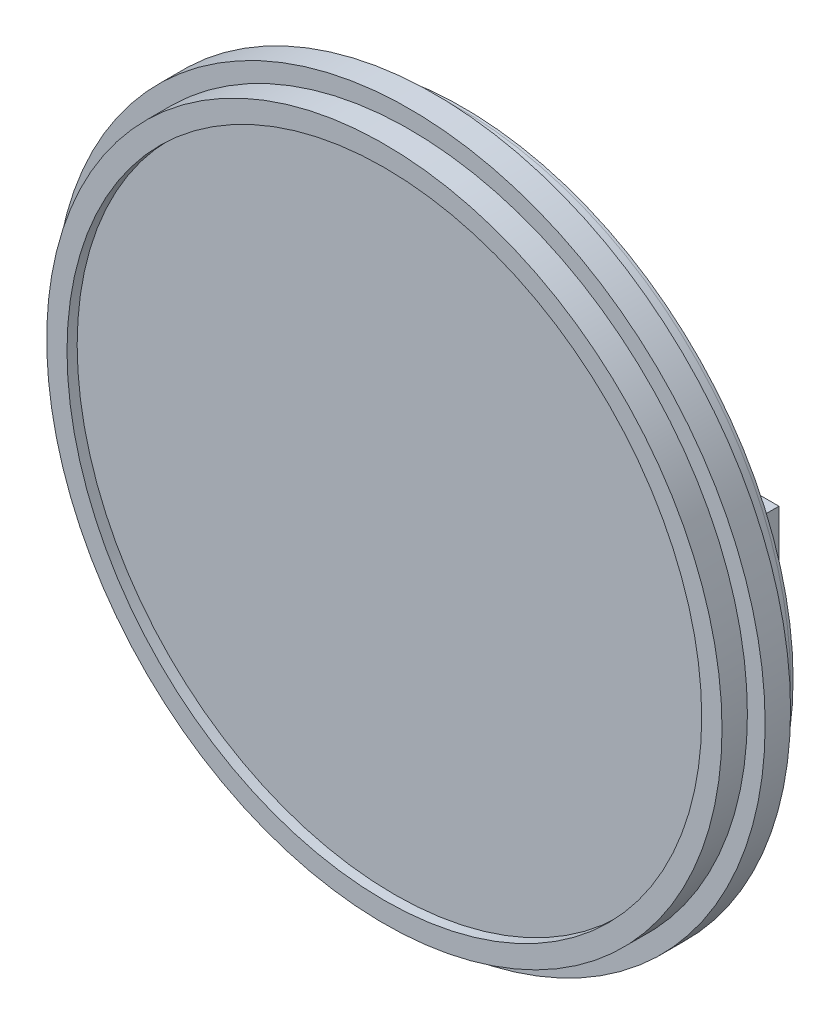
from build123d import *

# Parameters (mm, degrees)
SKETCH_1_R          = 14
EXTRUDE_1_DEPTH     = 1
SKETCH_2_R          = 13.3
EXTRUDE_2_DEPTH     = 1
SKETCH_3_R          = 12.5
CUT_EXTRUDE_2_DEPTH = 0.5
SKETCH_4_R          = 13
EXTRUDE_3_DEPTH     = 1
SKETCH_5_R          = 7.9
EXTRUDE_4_DEPTH     = 2
SKETCH_6_W          = 5.925942313
SKETCH_6_H          = 10.255153068
EXTRUDE_5_DEPTH     = 0.6
SKETCH_7_W          = 4.90352896
SKETCH_7_H          = 1.567823515
CUT_EXTRUDE_3_DEPTH = 0.6
SKETCH_8_R          = 12.5
EXTRUDE_6_DEPTH     = 0.1
SKETCH_9_R          = 13
EXTRUDE_7_DEPTH     = 0.1
EXTRUDE_9_DEPTH     = 0.1
EXTRUDE_9_2_DEPTH   = 0.1
EXTRUDE_9_3_DEPTH   = 0.1
EXTRUDE_9_4_DEPTH   = 0.1
EXTRUDE_9_5_DEPTH   = 0.1
EXTRUDE_9_6_DEPTH   = 0.1
EXTRUDE_9_7_DEPTH   = 0.1
EXTRUDE_9_8_DEPTH   = 0.1


with BuildPart() as part:
    # Эскиз1 → Бобышка-Вытянуть1 (new body)
    with BuildSketch(Plane.XY):
        Circle(SKETCH_1_R)
    extrude(amount=EXTRUDE_1_DEPTH)

    # Эскиз4 → Бобышка-Вытянуть3 (add)
    with BuildSketch(Plane(origin=(0, 0, 0), x_dir=(-1, 0, 0), z_dir=(0, 0, -1))):
        Circle(SKETCH_4_R)
    extrude(amount=EXTRUDE_3_DEPTH)

    # Эскиз5 → Бобышка-Вытянуть4 (add)
    with BuildSketch(Plane(origin=(0, 0, -1), x_dir=(-1, 0, 0), z_dir=(0, 0, -1))):
        Circle(SKETCH_5_R)
    extrude(amount=EXTRUDE_4_DEPTH)


with BuildPart() as body_2:
    # Эскиз2 → Бобышка-Вытянуть2 (new body)
    with BuildSketch(Plane.XY.offset(1)):
        Circle(SKETCH_2_R)
    extrude(amount=EXTRUDE_2_DEPTH)

    # Эскиз3 → Вырез-Вытянуть2 (cut)
    with BuildSketch(Plane.XY.offset(2)):
        Circle(SKETCH_3_R)
    extrude(amount=-CUT_EXTRUDE_2_DEPTH, mode=Mode.SUBTRACT)


with BuildPart() as body_3:
    # Эскиз6 → Бобышка-Вытянуть5 (new body)
    with BuildSketch(Plane(origin=(0, 0, -1), x_dir=(-1, 0, 0), z_dir=(0, 0, -1))):
        with Locations((-8.979626746, -0.00802035)):
            Rectangle(SKETCH_6_W, SKETCH_6_H)
    extrude(amount=EXTRUDE_5_DEPTH)


with BuildPart() as cut_extrude_3_tool:
    # Эскиз7 → Вырез-Вытянуть3 (new body)
    with BuildSketch(Plane(origin=(0, 0, -1.6), x_dir=(-1, 0, 0), z_dir=(0, 0, -1))):
        with Locations((-9.490833422, -0.069704626)):
            Rectangle(SKETCH_7_W, SKETCH_7_H)
    extrude(amount=-CUT_EXTRUDE_3_DEPTH)


with BuildPart() as part_1:
    add(part.part)

    # Вырез-Вытянуть3: cut by cut_extrude_3_tool
    add(cut_extrude_3_tool.part, mode=Mode.SUBTRACT)


with BuildPart() as body_3_1:
    add(body_3.part)

    # Вырез-Вытянуть3: cut by cut_extrude_3_tool
    add(cut_extrude_3_tool.part, mode=Mode.SUBTRACT)


with BuildPart() as body_4:
    # Эскиз8 → Бобышка-Вытянуть6 (new body)
    with BuildSketch(Plane.XY.offset(1.5)):
        Circle(SKETCH_8_R)
    extrude(amount=EXTRUDE_6_DEPTH)


with BuildPart() as body_5:
    # Эскиз9 → Бобышка-Вытянуть7 (new body)
    with BuildSketch(Plane(origin=(0, 0, -1), x_dir=(-1, 0, 0), z_dir=(0, 0, -1))):
        Circle(SKETCH_9_R)
    extrude(amount=EXTRUDE_7_DEPTH)


with BuildPart() as body_6:
    # Эскиз10 → Бобышка-Вытянуть9 (new body)
    with BuildSketch(Plane(origin=(0, 0, -3), x_dir=(-1, 0, 0), z_dir=(0, 0, -1))):
        with BuildLine():
            add(Edge.make_bspline(
                [(-4.168273117, 2.779709591), (-4.14661618, 2.768417207), (-4.104377919, 2.746393288), (-4.044221339, 2.710930936), (-3.989244701, 2.673555921), (-3.937922669, 2.636033575), (-3.891156922, 2.59692691), (-3.849470372, 2.556080417), (-3.811833302, 2.514513661), (-3.779004721, 2.47152277), (-3.750129731, 2.427221958), (-3.725174129, 2.381494948), (-3.703843268, 2.334441951), (-3.686937951, 2.285549348), (-3.673011953, 2.23553534), (-3.6634298, 2.183754128), (-3.658276534, 2.130546918), (-3.657302253, 2.094587547), (-3.656808941, 2.076380097)],
                knots=[0, 0, 0, 0, 1.272397273, 2.481599622, 3.635517121, 4.734568067, 5.792894095, 6.808321871, 7.773003508, 8.711915296, 9.623354172, 10.525449501, 11.423591555, 12.311487226, 13.218079475, 14.126165749, 15.051214107, 16, 16, 16, 16], degree=3))
            add(Edge.make_bspline(
                [(-3.656808941, 2.076380097), (-3.657392098, 2.050906216), (-3.658546385, 2.000483846), (-3.66860054, 1.926063274), (-3.683653803, 1.85378532), (-3.70563653, 1.78366583), (-3.734146057, 1.71609172), (-3.769280332, 1.651005147), (-3.809051898, 1.58733936), (-3.840992579, 1.54816636), (-3.857154494, 1.528344907)],
                knots=[0, 0, 0, 0, 1.025265484, 2.029385089, 3.018602448, 3.995076438, 4.983346944, 5.966715145, 6.97116228, 8, 8, 8, 8], degree=3))
            add(Edge.make_bspline(
                [(-3.857154494, 1.528344907), (-3.878197543, 1.505217471), (-3.920023606, 1.45924839), (-3.991674986, 1.399565337), (-4.070310577, 1.349408355), (-4.155626102, 1.308532577), (-4.247393506, 1.276717672), (-4.345593236, 1.253855769), (-4.450416732, 1.240760837), (-4.52246313, 1.23886794), (-4.559423958, 1.237896857)],
                knots=[0, 0, 0, 0, 0.954267603, 1.896743057, 2.838368354, 3.796610408, 4.779680527, 5.799409237, 6.871065594, 8, 8, 8, 8], degree=3))
            add(Edge.make_bspline(
                [(-4.559423958, 1.237896857), (-4.594963841, 1.238768075), (-4.664120844, 1.240463378), (-4.764781859, 1.251949645), (-4.858612989, 1.272079044), (-4.94615981, 1.299629433), (-5.026894537, 1.335469308), (-5.100587119, 1.380076855), (-5.168300777, 1.431656576), (-5.227980551, 1.491689838), (-5.280964077, 1.555989539), (-5.327506594, 1.622325577), (-5.36619176, 1.690704008), (-5.398944981, 1.76010525), (-5.424018427, 1.831502045), (-5.441384324, 1.904527055), (-5.45241315, 1.979052729), (-5.453880556, 2.02934749), (-5.45461877, 2.054649494)],
                knots=[0, 0, 0, 0, 1.256902934, 2.445805442, 3.576955095, 4.645999104, 5.686449165, 6.692658513, 7.68621702, 8.689161843, 9.678783111, 10.630372946, 11.551080876, 12.453998257, 13.34127905, 14.221779781, 15.105423033, 16, 16, 16, 16], degree=3))
            add(Edge.make_bspline(
                [(-5.45461877, 2.054649494), (-5.45418192, 2.073215074), (-5.453318549, 2.109907213), (-5.44734286, 2.16411605), (-5.437735868, 2.216878604), (-5.424688541, 2.268389762), (-5.407006039, 2.318274509), (-5.385656331, 2.366769213), (-5.360761343, 2.413928621), (-5.331973796, 2.460010632), (-5.298483575, 2.504369549), (-5.260562245, 2.547758188), (-5.217451891, 2.58950329), (-5.169632114, 2.630114885), (-5.117649396, 2.670313389), (-5.060153525, 2.70792635), (-4.998668692, 2.745616597), (-4.954970558, 2.768150272), (-4.9325543, 2.779709591)],
                knots=[0, 0, 0, 0, 0.941657376, 1.861047343, 2.762797495, 3.66048619, 4.553285746, 5.444104102, 6.34607688, 7.256116206, 8.197091036, 9.162375105, 10.176350973, 11.237807142, 12.343728897, 13.50695164, 14.721116704, 16, 16, 16, 16], degree=3))
            add(Edge.make_bspline(
                [(-4.9325543, 2.779709591), (-4.963239447, 2.796442422), (-5.022654479, 2.828841866), (-5.10132602, 2.888370702), (-5.168901075, 2.952844228), (-5.223522201, 3.023623895), (-5.266514897, 3.098498615), (-5.296011104, 3.176999925), (-5.315965589, 3.257672225), (-5.317942274, 3.312785838), (-5.318935009, 3.340465133)],
                knots=[0, 0, 0, 0, 1.166880483, 2.259407225, 3.286803203, 4.280235371, 5.237608625, 6.161067461, 7.076446754, 8, 8, 8, 8], degree=3))
            add(Edge.make_bspline(
                [(-5.318935009, 3.340465133), (-5.317698707, 3.368660311), (-5.315213523, 3.425337536), (-5.295117798, 3.509706451), (-5.262369891, 3.592571354), (-5.217828423, 3.673530613), (-5.162351182, 3.749844168), (-5.095792186, 3.818288812), (-5.019740884, 3.878244516), (-4.934576901, 3.928572932), (-4.84292808, 3.969533198), (-4.746229884, 3.997789506), (-4.646167119, 4.016262047), (-4.578057533, 4.018353506), (-4.543523518, 4.019413951)],
                knots=[0, 0, 0, 0, 0.888701115, 1.786444228, 2.72001202, 3.692817113, 4.693886446, 5.687152267, 6.695133018, 7.739871481, 8.800368666, 9.853104506, 10.91144658, 12, 12, 12, 12], degree=3))
            add(Edge.make_bspline(
                [(-4.543523518, 4.019413951), (-4.509880753, 4.018320584), (-4.443541053, 4.01616459), (-4.346027257, 3.998182843), (-4.252723927, 3.968149218), (-4.163952818, 3.927405484), (-4.081303132, 3.877220118), (-4.008276387, 3.816440886), (-3.943769018, 3.748298166), (-3.890410577, 3.672007751), (-3.846442203, 3.591359581), (-3.81582545, 3.506978271), (-3.796206993, 3.420687018), (-3.793732486, 3.362298765), (-3.792492702, 3.333044927)],
                knots=[0, 0, 0, 0, 1.072916533, 2.115669174, 3.151510826, 4.193348718, 5.225979165, 6.227137561, 7.216255879, 8.211077061, 9.189680878, 10.138522389, 11.067357538, 12, 12, 12, 12], degree=3))
            add(Edge.make_bspline(
                [(-3.792492702, 3.333044927), (-3.793577161, 3.304336378), (-3.795706978, 3.247954418), (-3.813623004, 3.165762346), (-3.843795568, 3.088789733), (-3.88499056, 3.016163156), (-3.938682447, 2.949199762), (-4.004154525, 2.887048026), (-4.080884809, 2.829197388), (-4.138534407, 2.796550553), (-4.168273117, 2.779709591)],
                knots=[0, 0, 0, 0, 0.975232327, 1.915300861, 2.843280834, 3.77672583, 4.742871857, 5.749627742, 6.839139064, 8, 8, 8, 8], degree=3))
        make_face()
        with BuildLine():
            add(Edge.make_bspline(
                [(-4.556773885, 3.74804643), (-4.575333125, 3.747553971), (-4.611643114, 3.746590508), (-4.664883835, 3.741556896), (-4.715511756, 3.731764881), (-4.764055843, 3.718733236), (-4.809850541, 3.701128626), (-4.853517793, 3.680419303), (-4.894314419, 3.655241504), (-4.932732904, 3.626998217), (-4.967318311, 3.595933937), (-4.998013418, 3.563568804), (-5.023510267, 3.529267169), (-5.045161581, 3.493882278), (-5.060871419, 3.456363925), (-5.072637292, 3.417862381), (-5.080590963, 3.377891109), (-5.081186948, 3.350573628), (-5.081488428, 3.33675503)],
                knots=[0, 0, 0, 0, 1.203892937, 2.355340988, 3.463153438, 4.544400666, 5.610487187, 6.640501085, 7.674077295, 8.714426146, 9.728707835, 10.68524104, 11.601827946, 12.495867327, 13.368432065, 14.231010473, 15.105153427, 16, 16, 16, 16], degree=3))
            add(Edge.make_bspline(
                [(-5.081488428, 3.33675503), (-5.080968812, 3.322935835), (-5.079941974, 3.295627121), (-5.072000598, 3.255300187), (-5.060164761, 3.215671926), (-5.041530035, 3.17768463), (-5.019179276, 3.140020543), (-4.991593458, 3.103620993), (-4.958717824, 3.068359303), (-4.921655413, 3.034535392), (-4.881278834, 3.002861922), (-4.838503992, 2.975365529), (-4.793867732, 2.952358791), (-4.747828668, 2.933210967), (-4.699917579, 2.918326312), (-4.650428043, 2.907766681), (-4.599351741, 2.901203504), (-4.564743802, 2.900419566), (-4.54723362, 2.900022925)],
                knots=[0, 0, 0, 0, 0.873023192, 1.725219244, 2.590779336, 3.480155217, 4.391973325, 5.357036234, 6.360879153, 7.436073238, 8.526419356, 9.601555421, 10.645666583, 11.697338044, 12.750135903, 13.812665442, 14.89329948, 16, 16, 16, 16], degree=3))
            add(Edge.make_bspline(
                [(-4.54723362, 2.900022925), (-4.524743959, 2.900682771), (-4.479986764, 2.901995946), (-4.414007746, 2.914205464), (-4.349855627, 2.933411128), (-4.288216099, 2.959688007), (-4.230684656, 2.992668592), (-4.179400795, 3.032154266), (-4.134801953, 3.077233292), (-4.097351611, 3.127203888), (-4.068315596, 3.180386339), (-4.045711254, 3.233756798), (-4.032511406, 3.287884675), (-4.030789674, 3.324145416), (-4.029939283, 3.342055177)],
                knots=[0, 0, 0, 0, 1.076279235, 2.141928126, 3.20205304, 4.278698113, 5.344010996, 6.36967002, 7.368914609, 8.37248503, 9.349703398, 10.264243087, 11.142681841, 12, 12, 12, 12], degree=3))
            add(Edge.make_bspline(
                [(-4.029939283, 3.342055177), (-4.030341372, 3.35462518), (-4.031139462, 3.379574835), (-4.03771629, 3.416418718), (-4.048583735, 3.452424416), (-4.063296897, 3.48788937), (-4.082656682, 3.522315995), (-4.105610562, 3.556245472), (-4.133493488, 3.588914532), (-4.164787221, 3.6210845), (-4.200275714, 3.650856946), (-4.239890576, 3.677039138), (-4.283428709, 3.699273479), (-4.330891142, 3.71733224), (-4.382103078, 3.730895802), (-4.436828644, 3.741053041), (-4.495524149, 3.746777953), (-4.535914496, 3.747614433), (-4.556773885, 3.74804643)],
                knots=[0, 0, 0, 0, 0.814439003, 1.616544685, 2.417341072, 3.248991801, 4.09997495, 4.973547432, 5.9003056, 6.880240646, 7.880314356, 8.896779544, 9.951930927, 11.043077905, 12.18215768, 13.381699519, 14.647792085, 16, 16, 16, 16], degree=3))
        make_face(mode=Mode.SUBTRACT)
        with BuildLine():
            add(Edge.make_bspline(
                [(-4.541403459, 2.628655404), (-4.564933071, 2.628236877), (-4.611092427, 2.62741583), (-4.678717605, 2.618276744), (-4.74361851, 2.605554524), (-4.805576319, 2.586254426), (-4.864564869, 2.56115946), (-4.920903492, 2.53097085), (-4.974161191, 2.495285782), (-5.023602538, 2.454557627), (-5.068750531, 2.410667444), (-5.10836115, 2.364204997), (-5.141999157, 2.316033796), (-5.169087388, 2.265542052), (-5.191321257, 2.213798917), (-5.205921629, 2.159515795), (-5.215281613, 2.103736251), (-5.216538483, 2.065817605), (-5.217172189, 2.046699274)],
                knots=[0, 0, 0, 0, 1.140299081, 2.23698856, 3.303958914, 4.344563908, 5.37730929, 6.408454204, 7.439741482, 8.480804886, 9.510774543, 10.48932336, 11.43758569, 12.353841022, 13.263987381, 14.161954604, 15.073269652, 16, 16, 16, 16], degree=3))
            add(Edge.make_bspline(
                [(-5.217172189, 2.046699274), (-5.21614163, 2.022939006), (-5.214097026, 1.975799189), (-5.197876829, 1.906128295), (-5.171845203, 1.838681427), (-5.135540427, 1.774008224), (-5.090585774, 1.713569751), (-5.035305646, 1.660888355), (-4.973135489, 1.614078666), (-4.901971754, 1.576220168), (-4.824238331, 1.545985962), (-4.739955893, 1.525154966), (-4.65033402, 1.511365298), (-4.588452066, 1.509975721), (-4.556773885, 1.509264378)],
                knots=[0, 0, 0, 0, 0.898778495, 1.783155532, 2.693654817, 3.627872908, 4.583023416, 5.533784346, 6.509005473, 7.520592997, 8.575161974, 9.658835044, 10.801527049, 12, 12, 12, 12], degree=3))
            add(Edge.make_bspline(
                [(-4.556773885, 1.509264378), (-4.532016166, 1.509739727), (-4.483780191, 1.51066586), (-4.413411647, 1.518840952), (-4.347005351, 1.531805251), (-4.284690081, 1.550661384), (-4.225768249, 1.573680116), (-4.171238869, 1.603292345), (-4.119699149, 1.636971779), (-4.07368877, 1.676930029), (-4.031783904, 1.719625837), (-3.995246237, 1.764824263), (-3.963528326, 1.811296913), (-3.938634091, 1.860094006), (-3.918732697, 1.910279352), (-3.904427391, 1.962315721), (-3.895600728, 2.016362712), (-3.894708027, 2.053025701), (-3.894255522, 2.071609965)],
                knots=[0, 0, 0, 0, 1.224942928, 2.386581632, 3.501229538, 4.569074225, 5.605009692, 6.626002462, 7.634866581, 8.645888296, 9.63523824, 10.59253846, 11.518950513, 12.414518923, 13.29783783, 14.186679152, 15.080837789, 16, 16, 16, 16], degree=3))
            add(Edge.make_bspline(
                [(-3.894255522, 2.071609965), (-3.894940301, 2.089660097), (-3.896290564, 2.125251805), (-3.904860563, 2.177991977), (-3.919916017, 2.228945295), (-3.940574228, 2.278724764), (-3.968076503, 2.326321756), (-4.000465185, 2.372976243), (-4.039543477, 2.417393317), (-4.083700618, 2.459917979), (-4.131823761, 2.499239399), (-4.1829769, 2.534024123), (-4.236766285, 2.563318878), (-4.293078094, 2.587143848), (-4.351787288, 2.605881994), (-4.412850686, 2.618972062), (-4.476339781, 2.627211643), (-4.519470546, 2.628168713), (-4.541403459, 2.628655404)],
                knots=[0, 0, 0, 0, 0.917430815, 1.809013306, 2.70690318, 3.612392954, 4.541220862, 5.495268465, 6.494511384, 7.542276156, 8.608045339, 9.649016899, 10.681629292, 11.715607085, 12.752076957, 13.808767841, 14.885711793, 16, 16, 16, 16], degree=3))
        make_face(mode=Mode.SUBTRACT)
    extrude(amount=EXTRUDE_9_DEPTH)


with BuildPart() as body_7:
    # Эскиз10 → Extrude 9 2 (new body)
    with BuildSketch(Plane(origin=(0, 0, -3), x_dir=(-1, 0, 0), z_dir=(0, 0, -1))):
        with BuildLine():
            Line((-1.57067112, 1.543185318), (-0.739608086, 1.543185318))
            Line((-0.739608086, 1.543185318), (-0.739608086, 1.305738737))
            Line((-0.739608086, 1.305738737), (-1.799637467, 1.305738737))
            Line((-1.799637467, 1.305738737), (-1.799637467, 1.638587963))
            add(Edge.make_bspline(
                [(-1.799637467, 1.638587963), (-1.753212017, 1.667164785), (-1.664097228, 1.722018694), (-1.538130234, 1.804409409), (-1.42617257, 1.884526251), (-1.327285463, 1.961188241), (-1.241627221, 2.034748183), (-1.168948173, 2.105157094), (-1.1096607, 2.172611842), (-1.063391598, 2.23840586), (-1.026990368, 2.303057268), (-0.99564101, 2.36712496), (-0.968934762, 2.43205634), (-0.947235012, 2.497787395), (-0.930162161, 2.564356126), (-0.917849429, 2.631631995), (-0.911002497, 2.699888928), (-0.909811563, 2.745597844), (-0.909212787, 2.768579282)],
                knots=[0, 0, 0, 0, 1.726964002, 3.314949702, 4.76710701, 6.087048124, 7.277484141, 8.342115976, 9.29034651, 10.117945271, 10.885025448, 11.63844732, 12.376368569, 13.107316574, 13.829469602, 14.551817793, 15.271885803, 16, 16, 16, 16], degree=3))
            add(Edge.make_bspline(
                [(-0.909212787, 2.768579282), (-0.910149043, 2.80501337), (-0.911978552, 2.876208091), (-0.925678264, 2.980203721), (-0.949795372, 3.078316694), (-0.982632089, 3.170926046), (-1.024523247, 3.258220808), (-1.077011872, 3.33899492), (-1.138455706, 3.414394279), (-1.208896944, 3.483411382), (-1.28656499, 3.545867999), (-1.370746147, 3.60027566), (-1.46083765, 3.645674519), (-1.556189367, 3.684023737), (-1.657911989, 3.711831356), (-1.764590307, 3.733528909), (-1.877273981, 3.745566602), (-1.954198336, 3.747206147), (-1.993622843, 3.74804643)],
                knots=[0, 0, 0, 0, 1.062437509, 2.076076205, 3.052086407, 4.003844546, 4.937153008, 5.869009602, 6.806518597, 7.768404322, 8.739669964, 9.708677912, 10.685721217, 11.677931361, 12.700644098, 13.756614884, 14.850242544, 16, 16, 16, 16], degree=3))
            add(Edge.make_bspline(
                [(-1.993622843, 3.74804643), (-2.033048662, 3.747204402), (-2.110151227, 3.745557702), (-2.22299046, 3.733503711), (-2.329996354, 3.712082995), (-2.431471117, 3.683025121), (-2.527629438, 3.646109289), (-2.617405537, 3.599588873), (-2.701813276, 3.545230913), (-2.779881485, 3.48303287), (-2.850545543, 3.41381967), (-2.911690597, 3.337994711), (-2.964251258, 3.257046657), (-3.006671681, 3.170128038), (-3.039846359, 3.077717826), (-3.062792989, 2.979537828), (-3.077600505, 2.875915124), (-3.079290459, 2.804849107), (-3.080152958, 2.768579282)],
                knots=[0, 0, 0, 0, 1.14892738, 2.246884138, 3.302092558, 4.325479714, 5.319883682, 6.298567514, 7.266875878, 8.241460862, 9.202652146, 10.143479939, 11.074663772, 12.009555506, 12.955777966, 13.929873195, 14.943473424, 16, 16, 16, 16], degree=3))
            add(Edge.make_bspline(
                [(-3.080152958, 2.768579282), (-3.079786912, 2.745771678), (-3.079058786, 2.70040359), (-3.071909815, 2.632733984), (-3.060152454, 2.566039675), (-3.044429045, 2.500058576), (-3.023373415, 2.435242772), (-2.998697116, 2.370971138), (-2.96872323, 2.307861915), (-2.933870333, 2.24403199), (-2.888907616, 2.179011416), (-2.830122086, 2.112416533), (-2.758146615, 2.041626851), (-2.671375223, 1.968192165), (-2.571398331, 1.889843255), (-2.456858912, 1.808767603), (-2.328407536, 1.723939181), (-2.237241861, 1.667830563), (-2.189728279, 1.638587963)],
                knots=[0, 0, 0, 0, 0.721480035, 1.435142872, 2.150161859, 2.863342861, 3.579344543, 4.304992334, 5.040202185, 5.788409948, 6.604059414, 7.535407846, 8.59480259, 9.795963414, 11.130050646, 12.612998473, 14.2347679, 16, 16, 16, 16], degree=3))
            Line((-2.189728279, 1.638587963), (-2.189728279, 1.305738737))
            Line((-2.189728279, 1.305738737), (-3.249757659, 1.305738737))
            Line((-3.249757659, 1.305738737), (-3.249757659, 1.543185318))
            Line((-3.249757659, 1.543185318), (-2.418694625, 1.543185318))
            add(Edge.make_bspline(
                [(-2.418694625, 1.543185318), (-2.462349921, 1.569908671), (-2.54683868, 1.621628005), (-2.665908074, 1.701443998), (-2.773316241, 1.780082743), (-2.869687932, 1.856792995), (-2.954574573, 1.932402883), (-3.028302265, 2.006566756), (-3.090174136, 2.079661563), (-3.140985361, 2.152430475), (-3.182467081, 2.225684659), (-3.218757482, 2.299590451), (-3.249784831, 2.375223246), (-3.273817355, 2.453274041), (-3.293898141, 2.532775788), (-3.307254584, 2.614526123), (-3.316261727, 2.697885071), (-3.317151489, 2.754068035), (-3.317599539, 2.782359664)],
                knots=[0, 0, 0, 0, 1.521507095, 2.944665499, 4.259859386, 5.477903256, 6.604940865, 7.637391614, 8.584217204, 9.448190317, 10.271606212, 11.084316444, 11.894783494, 12.698740799, 13.510160259, 14.330421164, 15.159262839, 16, 16, 16, 16], degree=3))
            add(Edge.make_bspline(
                [(-3.317599539, 2.782359664), (-3.316526206, 2.827293052), (-3.31442175, 2.915392729), (-3.296548205, 3.044117537), (-3.267514066, 3.166345739), (-3.2265163, 3.282048878), (-3.173926122, 3.391296693), (-3.109197411, 3.493744393), (-3.032909767, 3.589658088), (-2.945579892, 3.678123178), (-2.849691496, 3.758651461), (-2.745788753, 3.828069969), (-2.636023056, 3.887386582), (-2.519864916, 3.93571934), (-2.397223671, 3.973474533), (-2.268247738, 4.000322508), (-2.132900275, 4.016502435), (-2.040662589, 4.018430612), (-1.993622843, 4.019413951)],
                knots=[0, 0, 0, 0, 1.060031108, 2.07837429, 3.060328957, 4.020369746, 4.969556918, 5.915799986, 6.874309442, 7.856113616, 8.844790393, 9.824263403, 10.799921915, 11.784872792, 12.788496722, 13.823745093, 14.890144776, 16, 16, 16, 16], degree=3))
            add(Edge.make_bspline(
                [(-1.993622843, 4.019413951), (-1.946584005, 4.018426468), (-1.854348097, 4.016490165), (-1.719159791, 4.000389267), (-1.590395942, 3.97338687), (-1.4678996, 3.935741809), (-1.351787458, 3.88733352), (-1.242118068, 3.828397543), (-1.139039908, 3.758286432), (-1.043213502, 3.678176785), (-0.955973975, 3.589620887), (-0.879550956, 3.493911594), (-0.815535898, 3.391125236), (-0.762812189, 3.282072428), (-0.721861948, 3.166339248), (-0.692814665, 3.044119355), (-0.67494476, 2.915392245), (-0.672839798, 2.827292889), (-0.671766206, 2.782359664)],
                knots=[0, 0, 0, 0, 1.110772127, 2.178052811, 3.210072891, 4.214525961, 5.200290551, 6.176755099, 7.150120759, 8.139614327, 9.122229614, 10.081530939, 11.026337504, 11.976308843, 12.937142766, 13.91990867, 14.939093151, 16, 16, 16, 16], degree=3))
            add(Edge.make_bspline(
                [(-0.671766206, 2.782359664), (-0.672219642, 2.754069429), (-0.673120099, 2.697889235), (-0.682048171, 2.61450981), (-0.695693246, 2.532877227), (-0.714685375, 2.45308157), (-0.739788215, 2.375341793), (-0.770546869, 2.299571811), (-0.806915643, 2.225690062), (-0.848374425, 2.152427636), (-0.899198108, 2.079667776), (-0.961041302, 2.006541852), (-1.034790881, 1.932601556), (-1.119189619, 1.8564267), (-1.216051109, 1.780301833), (-1.323423829, 1.70140281), (-1.442536508, 1.621639497), (-1.527019041, 1.569912586), (-1.57067112, 1.543185318)],
                knots=[0, 0, 0, 0, 0.840708527, 1.669521974, 2.489754942, 3.299905053, 4.10542877, 4.915868217, 5.728550769, 6.551938621, 7.415882309, 8.362675653, 9.395091238, 10.51818009, 11.740285695, 13.055434789, 14.478544724, 16, 16, 16, 16], degree=3))
        make_face()
    extrude(amount=EXTRUDE_9_2_DEPTH)


with BuildPart() as body_8:
    # Эскиз10 → Extrude 9 3 (new body)
    with BuildSketch(Plane(origin=(0, 0, -3), x_dir=(-1, 0, 0), z_dir=(0, 0, -1))):
        Polygon((1.213496047, 3.951572071), (1.702699606, 3.951572071), (1.702699606, 1.305738737), (1.465253025, 1.305738737), (1.465253025, 3.680204549), (1.058201743, 3.680204549), align=None)
    extrude(amount=EXTRUDE_9_3_DEPTH)


with BuildPart() as body_9:
    # Эскиз10 → Extrude 9 4 (new body)
    with BuildSketch(Plane(origin=(0, 0, -3), x_dir=(-1, 0, 0), z_dir=(0, 0, -1))):
        Polygon((2.754248751, 3.951572071), (2.999645553, 3.951572071), (3.517469905, 2.01118829), (4.28758125, 3.951572071), (4.322032205, 3.951572071), (5.077833153, 2.024438657), (5.598307579, 3.951572071), (5.841054307, 3.951572071), (5.127654534, 1.305738737), (5.093733594, 1.305738737), (4.297651529, 3.329334824), (3.4920292, 1.305738737), (3.45810826, 1.305738737), align=None)
    extrude(amount=EXTRUDE_9_4_DEPTH)


with BuildPart() as body_10:
    # Эскиз10 → Extrude 9 5 (new body)
    with BuildSketch(Plane(origin=(0, 0, -3), x_dir=(-1, 0, 0), z_dir=(0, 0, -1))):
        with BuildLine():
            Line((-5.115409368, -2.272252716), (-5.35285595, -2.272252716))
            add(Edge.make_bspline(
                [(-5.35285595, -2.272252716), (-5.351308399, -2.240751509), (-5.348269052, -2.178883977), (-5.334035762, -2.088680786), (-5.313669742, -2.002460789), (-5.284874416, -1.920916271), (-5.249113123, -1.84332622), (-5.206227924, -1.769998827), (-5.155432572, -1.701213822), (-5.09782391, -1.637608863), (-5.035254761, -1.579258735), (-4.967743723, -1.528870545), (-4.896801351, -1.486297068), (-4.822642877, -1.450705891), (-4.744431618, -1.42399065), (-4.662877314, -1.404168339), (-4.577621658, -1.392242173), (-4.51953426, -1.39096024), (-4.489992034, -1.390308271)],
                knots=[0, 0, 0, 0, 1.10065271, 2.161652631, 3.183658789, 4.190468796, 5.17591951, 6.163126047, 7.15150782, 8.156236427, 9.156009102, 10.134482811, 11.092018607, 12.041330605, 13.001268258, 13.972401359, 14.968799086, 16, 16, 16, 16], degree=3))
            add(Edge.make_bspline(
                [(-4.489992034, -1.390308271), (-4.460980037, -1.390987462), (-4.403972501, -1.392322046), (-4.320770859, -1.403783062), (-4.241564214, -1.421733599), (-4.16650739, -1.446918467), (-4.096199234, -1.480773362), (-4.030111575, -1.521441739), (-3.967457629, -1.568476969), (-3.911058454, -1.623853364), (-3.859269608, -1.682970642), (-3.814591117, -1.746083522), (-3.776329976, -1.811268756), (-3.744438099, -1.879023408), (-3.720961137, -1.949985435), (-3.703137134, -2.023121714), (-3.693062244, -2.099189279), (-3.691516001, -2.150674592), (-3.690729881, -2.176850072)],
                knots=[0, 0, 0, 0, 1.111607364, 2.184268762, 3.212621178, 4.221274766, 5.211760367, 6.196651075, 7.1921475, 8.207485113, 9.220403448, 10.201281604, 11.166441695, 12.114753415, 13.065576456, 14.026450734, 14.996634279, 16, 16, 16, 16], degree=3))
            add(Edge.make_bspline(
                [(-3.690729881, -2.176850072), (-3.692009907, -2.213701113), (-3.694547497, -2.286756513), (-3.716254198, -2.394112986), (-3.750156025, -2.498127059), (-3.790975455, -2.581839186), (-3.832154029, -2.649295458), (-3.869261847, -2.704834301), (-3.912702508, -2.764634268), (-3.963108277, -2.828495112), (-4.019436461, -2.896917047), (-4.082197263, -2.969858737), (-4.151838228, -3.046566563), (-4.200716976, -3.098958297), (-4.226044718, -3.126106382)],
                knots=[0, 0, 0, 0, 1.184426356, 2.348067706, 3.509069118, 4.696110526, 5.333549288, 6.050745305, 6.844228056, 7.710549037, 8.667450064, 9.695053472, 10.805634456, 12, 12, 12, 12], degree=3))
            Line((-4.226044718, -3.126106382), (-4.888033066, -3.832615964))
            Line((-4.888033066, -3.832615964), (-3.656808941, -3.832615964))
            Line((-3.656808941, -3.832615964), (-3.656808941, -4.103983485))
            Line((-3.656808941, -4.103983485), (-5.45461877, -4.103983485))
            Line((-5.45461877, -4.103983485), (-4.42851033, -3.008973135))
            add(Edge.make_bspline(
                [(-4.42851033, -3.008973135), (-4.403527701, -2.982894058), (-4.355541184, -2.932801489), (-4.287669832, -2.859668417), (-4.226710596, -2.791822038), (-4.172268877, -2.72939054), (-4.125525691, -2.671460724), (-4.084044897, -2.619908776), (-4.050809004, -2.5724694), (-4.014738437, -2.517480959), (-3.979802867, -2.450343077), (-3.949782217, -2.368296776), (-3.931476945, -2.283836293), (-3.929281028, -2.226760349), (-3.928176462, -2.198050659)],
                knots=[0, 0, 0, 0, 1.329631726, 2.553950428, 3.673215718, 4.687767853, 5.603093632, 6.413772471, 7.123043292, 7.734684054, 8.834405432, 9.900288307, 10.943827018, 12, 12, 12, 12], degree=3))
            add(Edge.make_bspline(
                [(-3.928176462, -2.198050659), (-3.928657053, -2.179997459), (-3.929604206, -2.144418069), (-3.937963298, -2.092253001), (-3.950595645, -2.041933171), (-3.96869712, -1.993303799), (-3.992590311, -1.946853812), (-4.021674354, -1.902526669), (-4.055231128, -1.859672511), (-4.094050242, -1.819491148), (-4.136694665, -1.782690475), (-4.18174508, -1.75009072), (-4.229407956, -1.722846869), (-4.279482334, -1.700513392), (-4.331828612, -1.682993907), (-4.386548032, -1.670854386), (-4.443489402, -1.663232508), (-4.482370675, -1.662201259), (-4.502182372, -1.661675793)],
                knots=[0, 0, 0, 0, 0.991446411, 1.95395049, 2.89581595, 3.838931463, 4.798493298, 5.75982156, 6.748411868, 7.785213223, 8.824556874, 9.840280684, 10.836137867, 11.835679398, 12.848801643, 13.863922112, 14.911575587, 16, 16, 16, 16], degree=3))
            add(Edge.make_bspline(
                [(-4.502182372, -1.661675793), (-4.522873418, -1.662216323), (-4.563507216, -1.663277835), (-4.623166247, -1.670703302), (-4.68007871, -1.68351355), (-4.734387768, -1.701034012), (-4.786185312, -1.723303272), (-4.83521944, -1.751040484), (-4.881380077, -1.78413872), (-4.924753996, -1.821664617), (-4.964716647, -1.863444291), (-4.999828273, -1.91001849), (-5.030507855, -1.960536833), (-5.05727555, -2.014863012), (-5.079013482, -2.073489976), (-5.095624138, -2.13620961), (-5.108767766, -2.202749583), (-5.113158731, -2.248700213), (-5.115409368, -2.272252716)],
                knots=[0, 0, 0, 0, 1.031018746, 2.02475058, 2.990194455, 3.934040569, 4.864654155, 5.795059489, 6.735614925, 7.690564532, 8.649604399, 9.611025574, 10.590972636, 11.591080095, 12.624614302, 13.701020113, 14.821632451, 16, 16, 16, 16], degree=3))
        make_face()
    extrude(amount=EXTRUDE_9_5_DEPTH)


with BuildPart() as body_11:
    # Эскиз10 → Extrude 9 6 (new body)
    with BuildSketch(Plane(origin=(0, 0, -3), x_dir=(-1, 0, 0), z_dir=(0, 0, -1))):
        with BuildLine():
            add(Edge.make_bspline(
                [(-2.133016707, -2.630012632), (-2.111359769, -2.641305015), (-2.069121509, -2.663328934), (-2.008964929, -2.698791286), (-1.953988291, -2.736166301), (-1.902666259, -2.773688647), (-1.855900512, -2.812795312), (-1.814213961, -2.853641805), (-1.776576892, -2.895208561), (-1.743748311, -2.938199452), (-1.714873321, -2.982500265), (-1.689917719, -3.028227275), (-1.668586857, -3.075280271), (-1.651681541, -3.124172874), (-1.637755543, -3.174186882), (-1.628173389, -3.225968094), (-1.623020124, -3.279175304), (-1.622045843, -3.315134675), (-1.621552531, -3.333342125)],
                knots=[0, 0, 0, 0, 1.272397273, 2.481599622, 3.635517121, 4.734568067, 5.792894095, 6.808321871, 7.773003508, 8.711915296, 9.623354172, 10.525449501, 11.423591555, 12.311487226, 13.218079475, 14.126165749, 15.051214107, 16, 16, 16, 16], degree=3))
            add(Edge.make_bspline(
                [(-1.621552531, -3.333342125), (-1.622135688, -3.358816007), (-1.623289975, -3.409238376), (-1.633344129, -3.483658948), (-1.648397393, -3.555936902), (-1.670380119, -3.626056392), (-1.698889647, -3.693630502), (-1.734023922, -3.758717075), (-1.773795488, -3.822382862), (-1.805736168, -3.861555862), (-1.821898084, -3.881377315)],
                knots=[0, 0, 0, 0, 1.025265484, 2.029385089, 3.018602448, 3.995076438, 4.983346944, 5.966715145, 6.97116228, 8, 8, 8, 8], degree=3))
            add(Edge.make_bspline(
                [(-1.821898084, -3.881377315), (-1.842941133, -3.904504752), (-1.884767196, -3.950473832), (-1.956418576, -4.010156885), (-2.035054166, -4.060313868), (-2.120369692, -4.101189645), (-2.212137096, -4.13300455), (-2.310336825, -4.155866454), (-2.415160322, -4.168961385), (-2.48720672, -4.170854282), (-2.524167548, -4.171825365)],
                knots=[0, 0, 0, 0, 0.954267603, 1.896743057, 2.838368354, 3.796610408, 4.779680527, 5.799409237, 6.871065594, 8, 8, 8, 8], degree=3))
            add(Edge.make_bspline(
                [(-2.524167548, -4.171825365), (-2.559707431, -4.170954147), (-2.628864434, -4.169258844), (-2.729525448, -4.157772578), (-2.823356578, -4.137643178), (-2.9109034, -4.110092789), (-2.991638126, -4.074252914), (-3.065330709, -4.029645367), (-3.133044366, -3.978065646), (-3.192724141, -3.918032384), (-3.245707667, -3.853732683), (-3.292250183, -3.787396645), (-3.33093535, -3.719018214), (-3.363688571, -3.649616972), (-3.388762016, -3.578220177), (-3.406127913, -3.505195167), (-3.41715674, -3.430669494), (-3.418624146, -3.380374732), (-3.41936236, -3.355072728)],
                knots=[0, 0, 0, 0, 1.256902934, 2.445805442, 3.576955095, 4.645999104, 5.686449165, 6.692658513, 7.68621702, 8.689161843, 9.678783111, 10.630372946, 11.551080876, 12.453998257, 13.34127905, 14.221779781, 15.105423033, 16, 16, 16, 16], degree=3))
            add(Edge.make_bspline(
                [(-3.41936236, -3.355072728), (-3.418925509, -3.336507148), (-3.418062138, -3.29981501), (-3.41208645, -3.245606172), (-3.402479458, -3.192843618), (-3.389432131, -3.141332461), (-3.371749628, -3.091447713), (-3.350399921, -3.04295301), (-3.325504933, -2.995793601), (-3.296717385, -2.94971159), (-3.263227165, -2.905352673), (-3.225305834, -2.861964034), (-3.182195481, -2.820218932), (-3.134375703, -2.779607337), (-3.082392986, -2.739408833), (-3.024897115, -2.701795872), (-2.963412281, -2.664105625), (-2.919714147, -2.64157195), (-2.89729789, -2.630012632)],
                knots=[0, 0, 0, 0, 0.941657376, 1.861047343, 2.762797495, 3.66048619, 4.553285746, 5.444104102, 6.34607688, 7.256116206, 8.197091036, 9.162375105, 10.176350973, 11.237807142, 12.343728897, 13.50695164, 14.721116704, 16, 16, 16, 16], degree=3))
            add(Edge.make_bspline(
                [(-2.89729789, -2.630012632), (-2.927983036, -2.613279801), (-2.987398068, -2.580880356), (-3.06606961, -2.521351521), (-3.133644665, -2.456877994), (-3.188265791, -2.386098328), (-3.231258487, -2.311223607), (-3.260754694, -2.232722297), (-3.280709179, -2.152049997), (-3.282685864, -2.096936384), (-3.283678599, -2.069257089)],
                knots=[0, 0, 0, 0, 1.166880483, 2.259407225, 3.286803203, 4.280235371, 5.237608625, 6.161067461, 7.076446754, 8, 8, 8, 8], degree=3))
            add(Edge.make_bspline(
                [(-3.283678599, -2.069257089), (-3.282442296, -2.041061911), (-3.279957112, -1.984384686), (-3.259861388, -1.900015772), (-3.22711348, -1.817150868), (-3.182572012, -1.736191609), (-3.127094772, -1.659878054), (-3.060535776, -1.59143341), (-2.984484474, -1.531477706), (-2.899320491, -1.48114929), (-2.80767167, -1.440189024), (-2.710973474, -1.411932716), (-2.610910708, -1.393460176), (-2.542801123, -1.391368717), (-2.508267107, -1.390308271)],
                knots=[0, 0, 0, 0, 0.888701115, 1.786444228, 2.72001202, 3.692817113, 4.693886446, 5.687152267, 6.695133018, 7.739871481, 8.800368666, 9.853104506, 10.91144658, 12, 12, 12, 12], degree=3))
            add(Edge.make_bspline(
                [(-2.508267107, -1.390308271), (-2.474624342, -1.391401638), (-2.408284643, -1.393557632), (-2.310770847, -1.411539379), (-2.217467517, -1.441573004), (-2.128696408, -1.482316739), (-2.046046722, -1.532502104), (-1.973019976, -1.593281337), (-1.908512608, -1.661424057), (-1.855154167, -1.737714471), (-1.811185792, -1.818362641), (-1.78056904, -1.902743952), (-1.760950583, -1.989035204), (-1.758476076, -2.047423457), (-1.757236291, -2.076677295)],
                knots=[0, 0, 0, 0, 1.072916533, 2.115669174, 3.151510826, 4.193348718, 5.225979165, 6.227137561, 7.216255879, 8.211077061, 9.189680878, 10.138522389, 11.067357538, 12, 12, 12, 12], degree=3))
            add(Edge.make_bspline(
                [(-1.757236291, -2.076677295), (-1.758320751, -2.105385845), (-1.760450568, -2.161767804), (-1.778366594, -2.243959876), (-1.808539158, -2.320932489), (-1.84973415, -2.393559066), (-1.903426037, -2.46052246), (-1.968898115, -2.522674196), (-2.045628399, -2.580524834), (-2.103277997, -2.613171669), (-2.133016707, -2.630012632)],
                knots=[0, 0, 0, 0, 0.975232327, 1.915300861, 2.843280834, 3.77672583, 4.742871857, 5.749627742, 6.839139064, 8, 8, 8, 8], degree=3))
        make_face()
        with BuildLine():
            add(Edge.make_bspline(
                [(-2.521517475, -1.661675793), (-2.540076715, -1.662168251), (-2.576386704, -1.663131714), (-2.629627425, -1.668165326), (-2.680255346, -1.677957342), (-2.728799433, -1.690988987), (-2.77459413, -1.708593597), (-2.818261383, -1.729302919), (-2.859058009, -1.754480719), (-2.897476494, -1.782724005), (-2.932061901, -1.813788285), (-2.962757008, -1.846153418), (-2.988253856, -1.880455054), (-3.009905171, -1.915839945), (-3.025615009, -1.953358297), (-3.037380881, -1.991859841), (-3.045334552, -2.031831113), (-3.045930538, -2.059148595), (-3.046232018, -2.072967192)],
                knots=[0, 0, 0, 0, 1.203892937, 2.355340988, 3.463153438, 4.544400666, 5.610487187, 6.640501085, 7.674077295, 8.714426146, 9.728707835, 10.68524104, 11.601827946, 12.495867327, 13.368432065, 14.231010473, 15.105153427, 16, 16, 16, 16], degree=3))
            add(Edge.make_bspline(
                [(-3.046232018, -2.072967192), (-3.045712401, -2.086786387), (-3.044685564, -2.114095101), (-3.036744188, -2.154422035), (-3.024908351, -2.194050296), (-3.006273625, -2.232037592), (-2.983922866, -2.269701679), (-2.956337048, -2.306101229), (-2.923461413, -2.341362919), (-2.886399003, -2.37518683), (-2.846022424, -2.4068603), (-2.803247582, -2.434356693), (-2.758611322, -2.457363431), (-2.712572257, -2.476511255), (-2.664661169, -2.49139591), (-2.615171633, -2.501955542), (-2.56409533, -2.508518718), (-2.529487391, -2.509302657), (-2.51197721, -2.509699297)],
                knots=[0, 0, 0, 0, 0.873023192, 1.725219244, 2.590779336, 3.480155217, 4.391973325, 5.357036234, 6.360879153, 7.436073238, 8.526419356, 9.601555421, 10.645666583, 11.697338044, 12.750135903, 13.812665442, 14.89329948, 16, 16, 16, 16], degree=3))
            add(Edge.make_bspline(
                [(-2.51197721, -2.509699297), (-2.489487548, -2.509039451), (-2.444730354, -2.507726276), (-2.378751335, -2.495516758), (-2.314599217, -2.476311094), (-2.252959688, -2.450034215), (-2.195428246, -2.41705363), (-2.144144385, -2.377567956), (-2.099545543, -2.33248893), (-2.062095201, -2.282518334), (-2.033059186, -2.229335883), (-2.010454843, -2.175965424), (-1.997254996, -2.121837547), (-1.995533264, -2.085576806), (-1.994682873, -2.067667045)],
                knots=[0, 0, 0, 0, 1.076279235, 2.141928126, 3.20205304, 4.278698113, 5.344010996, 6.36967002, 7.368914609, 8.37248503, 9.349703398, 10.264243087, 11.142681841, 12, 12, 12, 12], degree=3))
            add(Edge.make_bspline(
                [(-1.994682873, -2.067667045), (-1.995084962, -2.055097042), (-1.995883051, -2.030147387), (-2.002459879, -1.993303504), (-2.013327325, -1.957297807), (-2.028040486, -1.921832852), (-2.047400272, -1.887406227), (-2.070354151, -1.85347675), (-2.098237078, -1.82080769), (-2.12953081, -1.788637722), (-2.165019304, -1.758865276), (-2.204634166, -1.732683084), (-2.248172299, -1.710448743), (-2.295634731, -1.692389982), (-2.346846668, -1.67882642), (-2.401572234, -1.668669181), (-2.460267738, -1.662944269), (-2.500658086, -1.662107789), (-2.521517475, -1.661675793)],
                knots=[0, 0, 0, 0, 0.814439003, 1.616544685, 2.417341072, 3.248991801, 4.09997495, 4.973547432, 5.9003056, 6.880240646, 7.880314356, 8.896779544, 9.951930927, 11.043077905, 12.18215768, 13.381699519, 14.647792085, 16, 16, 16, 16], degree=3))
        make_face(mode=Mode.SUBTRACT)
        with BuildLine():
            add(Edge.make_bspline(
                [(-2.506147049, -2.781066818), (-2.52967666, -2.781485345), (-2.575836017, -2.782306392), (-2.643461195, -2.791445478), (-2.7083621, -2.804167698), (-2.770319909, -2.823467796), (-2.829308458, -2.848562762), (-2.885647081, -2.878751373), (-2.938904781, -2.91443644), (-2.988346127, -2.955164596), (-3.03349412, -2.999054778), (-3.07310474, -3.045517225), (-3.106742747, -3.093688426), (-3.133830978, -3.144180171), (-3.156064847, -3.195923305), (-3.170665218, -3.250206428), (-3.180025203, -3.305985972), (-3.181282073, -3.343904617), (-3.181915779, -3.363022948)],
                knots=[0, 0, 0, 0, 1.140299081, 2.23698856, 3.303958914, 4.344563908, 5.37730929, 6.408454204, 7.439741482, 8.480804886, 9.510774543, 10.48932336, 11.43758569, 12.353841022, 13.263987381, 14.161954604, 15.073269652, 16, 16, 16, 16], degree=3))
            add(Edge.make_bspline(
                [(-3.181915779, -3.363022948), (-3.18088522, -3.386783216), (-3.178840615, -3.433923034), (-3.162620418, -3.503593927), (-3.136588793, -3.571040796), (-3.100284017, -3.635713998), (-3.055329364, -3.696152471), (-3.000049236, -3.748833867), (-2.937879079, -3.795643556), (-2.866715344, -3.833502055), (-2.78898192, -3.863736261), (-2.704699483, -3.884567256), (-2.615077609, -3.898356924), (-2.553195656, -3.899746501), (-2.521517475, -3.900457844)],
                knots=[0, 0, 0, 0, 0.898778495, 1.783155532, 2.693654817, 3.627872908, 4.583023416, 5.533784346, 6.509005473, 7.520592997, 8.575161974, 9.658835044, 10.801527049, 12, 12, 12, 12], degree=3))
            add(Edge.make_bspline(
                [(-2.521517475, -3.900457844), (-2.496759756, -3.899982495), (-2.448523781, -3.899056362), (-2.378155236, -3.890881271), (-2.311748941, -3.877916971), (-2.24943367, -3.859060838), (-2.190511839, -3.836042106), (-2.135982458, -3.806429877), (-2.084442738, -3.772750443), (-2.03843236, -3.732792194), (-1.996527494, -3.690096385), (-1.959989826, -3.64489796), (-1.928271916, -3.598425309), (-1.903377681, -3.549628216), (-1.883476287, -3.49944287), (-1.869170981, -3.447406502), (-1.860344318, -3.39335951), (-1.859451617, -3.356696522), (-1.858999112, -3.338112258)],
                knots=[0, 0, 0, 0, 1.224942928, 2.386581632, 3.501229538, 4.569074225, 5.605009692, 6.626002462, 7.634866581, 8.645888296, 9.63523824, 10.59253846, 11.518950513, 12.414518923, 13.29783783, 14.186679152, 15.080837789, 16, 16, 16, 16], degree=3))
            add(Edge.make_bspline(
                [(-1.858999112, -3.338112258), (-1.85968389, -3.320062125), (-1.861034154, -3.284470417), (-1.869604152, -3.231730245), (-1.884659607, -3.180776927), (-1.905317818, -3.130997458), (-1.932820093, -3.083400466), (-1.965208775, -3.036745979), (-2.004287067, -2.992328905), (-2.048444208, -2.949804243), (-2.096567351, -2.910482823), (-2.14772049, -2.875698099), (-2.201509875, -2.846403344), (-2.257821683, -2.822578375), (-2.316530877, -2.803840228), (-2.377594276, -2.79075016), (-2.441083371, -2.782510579), (-2.484214136, -2.781553509), (-2.506147049, -2.781066818)],
                knots=[0, 0, 0, 0, 0.917430815, 1.809013306, 2.70690318, 3.612392954, 4.541220862, 5.495268465, 6.494511384, 7.542276156, 8.608045339, 9.649016899, 10.681629292, 11.715607085, 12.752076957, 13.808767841, 14.885711793, 16, 16, 16, 16], degree=3))
        make_face(mode=Mode.SUBTRACT)
    extrude(amount=EXTRUDE_9_6_DEPTH)


with BuildPart() as body_12:
    # Эскиз10 → Extrude 9 7 (new body)
    with BuildSketch(Plane(origin=(0, 0, -3), x_dir=(-1, 0, 0), z_dir=(0, 0, -1))):
        with BuildLine():
            Line((-1.214501249, -2.170489895), (-0.977054667, -2.170489895))
            Line((-0.977054667, -2.170489895), (-0.977054667, -2.506519209))
            add(Edge.make_bspline(
                [(-0.977054667, -2.506519209), (-0.955673348, -2.477122034), (-0.914704691, -2.420794228), (-0.847526489, -2.346567049), (-0.780415975, -2.283574932), (-0.732085383, -2.250507404), (-0.708867234, -2.234621673)],
                knots=[0, 0, 0, 0, 1.134379233, 2.173579362, 3.122582517, 4, 4, 4, 4], degree=3))
            add(Edge.make_bspline(
                [(-0.708867234, -2.234621673), (-0.677219543, -2.219498569), (-0.614477083, -2.189516581), (-0.515130407, -2.159101926), (-0.413473961, -2.140410927), (-0.344827275, -2.137854769), (-0.310296187, -2.136568955)],
                knots=[0, 0, 0, 0, 1.014936303, 2.012140481, 3.000054389, 4, 4, 4, 4], degree=3))
            add(Edge.make_bspline(
                [(-0.310296187, -2.136568955), (-0.286942553, -2.137359145), (-0.240726966, -2.138922889), (-0.172249708, -2.149098034), (-0.105832781, -2.166686153), (-0.041868604, -2.191184547), (0.018396433, -2.220853173), (0.073648386, -2.25566456), (0.123257163, -2.294745087), (0.16719769, -2.339859518), (0.206710584, -2.392274685), (0.243055902, -2.453404207), (0.276639247, -2.524620712), (0.295251784, -2.576302562), (0.305050868, -2.603511897)],
                knots=[0, 0, 0, 0, 1.009824226, 1.998387844, 2.986035974, 3.974953746, 4.955485308, 5.885931332, 6.793869504, 7.679848016, 8.601185859, 9.625726857, 10.749998409, 12, 12, 12, 12], degree=3))
            add(Edge.make_bspline(
                [(0.305050868, -2.603511897), (0.315415921, -2.584821414), (0.33581289, -2.548041167), (0.370061794, -2.495987599), (0.405945188, -2.447299132), (0.443768882, -2.401937132), (0.483399373, -2.36012561), (0.52502317, -2.321726327), (0.568403332, -2.28657438), (0.628722466, -2.245508658), (0.707199854, -2.201889313), (0.806145036, -2.164070191), (0.909068082, -2.14069907), (0.978931461, -2.137954757), (1.014210523, -2.136568955)],
                knots=[0, 0, 0, 0, 0.86119277, 1.694706429, 2.50939023, 3.298075842, 4.073795165, 4.829715201, 5.57930267, 6.321991688, 7.768977793, 9.186738141, 10.579381044, 12, 12, 12, 12], degree=3))
            add(Edge.make_bspline(
                [(1.014210523, -2.136568955), (1.046626867, -2.137791497), (1.1100688, -2.14018413), (1.202428995, -2.158972173), (1.288563574, -2.191234442), (1.368299221, -2.235256298), (1.440235508, -2.290576276), (1.502765099, -2.356396171), (1.555508171, -2.432250416), (1.589963453, -2.503606264), (1.61333392, -2.566603807), (1.627743306, -2.620281182), (1.640473313, -2.679360035), (1.651042469, -2.743911006), (1.658767208, -2.814162121), (1.664490308, -2.889998414), (1.668363864, -2.971478826), (1.668637573, -3.027695603), (1.668778666, -3.056674457)],
                knots=[0, 0, 0, 0, 1.209669288, 2.367440248, 3.500751976, 4.631527125, 5.755587489, 6.87532382, 8.007944318, 9.190864318, 9.82315674, 10.514484317, 11.263564316, 12.079023757, 12.955305781, 13.901327259, 14.918167583, 16, 16, 16, 16], degree=3))
            Line((1.668778666, -3.056674457), (1.668778666, -4.103983485))
            Line((1.668778666, -4.103983485), (1.431332085, -4.103983485))
            Line((1.431332085, -4.103983485), (1.431332085, -3.055614428))
            add(Edge.make_bspline(
                [(1.431332085, -3.055614428), (1.431273209, -3.030879232), (1.431160058, -2.983341948), (1.429123801, -2.915115392), (1.425287106, -2.852924432), (1.420800801, -2.796853865), (1.414568874, -2.746772936), (1.406521056, -2.702782238), (1.397995667, -2.664535726), (1.38383215, -2.622137345), (1.36119297, -2.575366412), (1.326708328, -2.524926566), (1.283263664, -2.481020247), (1.233098546, -2.4429064), (1.175987519, -2.41191716), (1.113043353, -2.38978589), (1.044656838, -2.376085857), (0.997316992, -2.374720595), (0.972869378, -2.374015536)],
                knots=[0, 0, 0, 0, 1.253487763, 2.409012846, 3.458416907, 4.410876679, 5.259312806, 6.014470957, 6.676830364, 7.243083969, 8.276244668, 9.299465089, 10.325150304, 11.392391894, 12.482080715, 13.603491619, 14.762376348, 16, 16, 16, 16], degree=3))
            add(Edge.make_bspline(
                [(0.972869378, -2.374015536), (0.942880781, -2.375086084), (0.883611914, -2.377201893), (0.797096576, -2.39880238), (0.713963724, -2.431368998), (0.636693951, -2.478564963), (0.565613419, -2.535116524), (0.50445719, -2.602358182), (0.453935241, -2.678429615), (0.41972539, -2.748844086), (0.398113239, -2.812094202), (0.38384319, -2.867352334), (0.372743245, -2.930158043), (0.362333381, -3.000089301), (0.355539087, -3.077627473), (0.349364186, -3.162413884), (0.346475796, -3.254703543), (0.34607177, -3.31867729), (0.345861999, -3.35189264)],
                knots=[0, 0, 0, 0, 1.090531906, 2.155305635, 3.229839962, 4.33261226, 5.44038871, 6.529323825, 7.629011124, 8.757537029, 9.370236727, 10.061839251, 10.834451254, 11.692844982, 12.636905849, 13.66920014, 14.789842145, 16, 16, 16, 16], degree=3))
            Line((0.345861999, -3.35189264), (0.345861999, -4.103983485))
            Line((0.345861999, -4.103983485), (0.108415418, -4.103983485))
            Line((0.108415418, -4.103983485), (0.108415418, -3.120806235))
            add(Edge.make_bspline(
                [(0.108415418, -3.120806235), (0.108355372, -3.093067833), (0.108239849, -3.039701936), (0.106216681, -2.963174098), (0.102371437, -2.893565187), (0.097926023, -2.830956104), (0.091530531, -2.775460635), (0.084266008, -2.726781264), (0.075686999, -2.68504003), (0.061482741, -2.639256995), (0.03977597, -2.588819154), (0.004859844, -2.53503993), (-0.038688744, -2.487968214), (-0.089769108, -2.447782731), (-0.147225785, -2.414565064), (-0.210713237, -2.390631799), (-0.279659808, -2.376703913), (-0.327192359, -2.374928562), (-0.351637333, -2.374015536)],
                knots=[0, 0, 0, 0, 1.320475261, 2.540461679, 3.643808994, 4.639130445, 5.527981419, 6.302341397, 6.981980563, 7.553956391, 8.582137848, 9.585246428, 10.591171744, 11.620968678, 12.668337649, 13.738356861, 14.836885341, 16, 16, 16, 16], degree=3))
            add(Edge.make_bspline(
                [(-0.351637333, -2.374015536), (-0.380375779, -2.375172491), (-0.43765048, -2.377478261), (-0.521789469, -2.398232385), (-0.603043528, -2.430741418), (-0.680116425, -2.4758414), (-0.75092962, -2.531705584), (-0.812923965, -2.597409107), (-0.865041231, -2.672134269), (-0.899612306, -2.741806255), (-0.921911748, -2.803471766), (-0.936724888, -2.85589778), (-0.949454843, -2.914106301), (-0.958914847, -2.978276915), (-0.968047066, -3.04799167), (-0.972454502, -3.123597862), (-0.976741933, -3.205030631), (-0.976947866, -3.261252733), (-0.977054667, -3.290410936)],
                knots=[0, 0, 0, 0, 1.098833095, 2.189935336, 3.297829714, 4.440610912, 5.596351641, 6.740013378, 7.886572111, 9.072425424, 9.705826452, 10.395263256, 11.156850408, 11.985370555, 12.878090359, 13.847760091, 14.883794034, 16, 16, 16, 16], degree=3))
            Line((-0.977054667, -3.290410936), (-0.977054667, -4.103983485))
            Line((-0.977054667, -4.103983485), (-1.214501249, -4.103983485))
            Line((-1.214501249, -4.103983485), (-1.214501249, -2.170489895))
        make_face()
    extrude(amount=EXTRUDE_9_7_DEPTH)


with BuildPart() as body_13:
    # Эскиз10 → Extrude 9 8 (new body)
    with BuildSketch(Plane(origin=(0, 0, -3), x_dir=(-1, 0, 0), z_dir=(0, 0, -1))):
        with BuildLine():
            Line((2.211513709, -2.170489895), (2.44896029, -2.170489895))
            Line((2.44896029, -2.170489895), (2.44896029, -2.506519209))
            add(Edge.make_bspline(
                [(2.44896029, -2.506519209), (2.470341609, -2.477122034), (2.511310267, -2.420794228), (2.578488468, -2.346567049), (2.645598982, -2.283574932), (2.693929574, -2.250507404), (2.717147723, -2.234621673)],
                knots=[0, 0, 0, 0, 1.134379233, 2.173579362, 3.122582517, 4, 4, 4, 4], degree=3))
            add(Edge.make_bspline(
                [(2.717147723, -2.234621673), (2.748795414, -2.219498569), (2.811537874, -2.189516581), (2.91088455, -2.159101926), (3.012540997, -2.140410927), (3.081187682, -2.137854769), (3.11571877, -2.136568955)],
                knots=[0, 0, 0, 0, 1.014936303, 2.012140481, 3.000054389, 4, 4, 4, 4], degree=3))
            add(Edge.make_bspline(
                [(3.11571877, -2.136568955), (3.139072404, -2.137359145), (3.185287991, -2.138922889), (3.253765249, -2.149098034), (3.320182176, -2.166686153), (3.384146353, -2.191184547), (3.44441139, -2.220853173), (3.499663344, -2.25566456), (3.54927212, -2.294745087), (3.593212647, -2.339859518), (3.632725541, -2.392274685), (3.66907086, -2.453404207), (3.702654205, -2.524620712), (3.721266742, -2.576302562), (3.731065825, -2.603511897)],
                knots=[0, 0, 0, 0, 1.009824226, 1.998387844, 2.986035974, 3.974953746, 4.955485308, 5.885931332, 6.793869504, 7.679848016, 8.601185859, 9.625726857, 10.749998409, 12, 12, 12, 12], degree=3))
            add(Edge.make_bspline(
                [(3.731065825, -2.603511897), (3.741430878, -2.584821414), (3.761827847, -2.548041167), (3.796076752, -2.495987599), (3.831960145, -2.447299132), (3.869783839, -2.401937132), (3.909414331, -2.36012561), (3.951038127, -2.321726327), (3.994418289, -2.28657438), (4.054737423, -2.245508658), (4.133214811, -2.201889313), (4.232159993, -2.164070191), (4.335083039, -2.14069907), (4.404946418, -2.137954757), (4.440225481, -2.136568955)],
                knots=[0, 0, 0, 0, 0.86119277, 1.694706429, 2.50939023, 3.298075842, 4.073795165, 4.829715201, 5.57930267, 6.321991688, 7.768977793, 9.186738141, 10.579381044, 12, 12, 12, 12], degree=3))
            add(Edge.make_bspline(
                [(4.440225481, -2.136568955), (4.472641825, -2.137791497), (4.536083757, -2.14018413), (4.628443952, -2.158972173), (4.714578531, -2.191234442), (4.794314178, -2.235256298), (4.866250465, -2.290576276), (4.928780056, -2.356396171), (4.981523129, -2.432250416), (5.01597841, -2.503606264), (5.039348877, -2.566603807), (5.053758263, -2.620281182), (5.06648827, -2.679360035), (5.077057426, -2.743911006), (5.084782165, -2.814162121), (5.090505265, -2.889998414), (5.094378821, -2.971478826), (5.09465253, -3.027695603), (5.094793623, -3.056674457)],
                knots=[0, 0, 0, 0, 1.209669288, 2.367440248, 3.500751976, 4.631527125, 5.755587489, 6.87532382, 8.007944318, 9.190864318, 9.82315674, 10.514484317, 11.263564316, 12.079023757, 12.955305781, 13.901327259, 14.918167583, 16, 16, 16, 16], degree=3))
            Line((5.094793623, -3.056674457), (5.094793623, -4.103983485))
            Line((5.094793623, -4.103983485), (4.857347042, -4.103983485))
            Line((4.857347042, -4.103983485), (4.857347042, -3.055614428))
            add(Edge.make_bspline(
                [(4.857347042, -3.055614428), (4.857288166, -3.030879232), (4.857175016, -2.983341948), (4.855138759, -2.915115392), (4.851302063, -2.852924432), (4.846815758, -2.796853865), (4.840583831, -2.746772936), (4.832536014, -2.702782238), (4.824010625, -2.664535726), (4.809847108, -2.622137345), (4.787207928, -2.575366412), (4.752723285, -2.524926566), (4.709278621, -2.481020247), (4.659113503, -2.4429064), (4.602002476, -2.41191716), (4.539058311, -2.38978589), (4.470671795, -2.376085857), (4.423331949, -2.374720595), (4.398884335, -2.374015536)],
                knots=[0, 0, 0, 0, 1.253487763, 2.409012846, 3.458416907, 4.410876679, 5.259312806, 6.014470957, 6.676830364, 7.243083969, 8.276244668, 9.299465089, 10.325150304, 11.392391894, 12.482080715, 13.603491619, 14.762376348, 16, 16, 16, 16], degree=3))
            add(Edge.make_bspline(
                [(4.398884335, -2.374015536), (4.368895738, -2.375086084), (4.309626871, -2.377201893), (4.223111533, -2.39880238), (4.139978681, -2.431368998), (4.062708908, -2.478564963), (3.991628376, -2.535116524), (3.930472148, -2.602358182), (3.879950198, -2.678429615), (3.845740347, -2.748844086), (3.824128197, -2.812094202), (3.809858147, -2.867352334), (3.798758202, -2.930158043), (3.788348338, -3.000089301), (3.781554044, -3.077627473), (3.775379143, -3.162413884), (3.772490753, -3.254703543), (3.772086728, -3.31867729), (3.771876956, -3.35189264)],
                knots=[0, 0, 0, 0, 1.090531906, 2.155305635, 3.229839962, 4.33261226, 5.44038871, 6.529323825, 7.629011124, 8.757537029, 9.370236727, 10.061839251, 10.834451254, 11.692844982, 12.636905849, 13.66920014, 14.789842145, 16, 16, 16, 16], degree=3))
            Line((3.771876956, -3.35189264), (3.771876956, -4.103983485))
            Line((3.771876956, -4.103983485), (3.534430375, -4.103983485))
            Line((3.534430375, -4.103983485), (3.534430375, -3.120806235))
            add(Edge.make_bspline(
                [(3.534430375, -3.120806235), (3.534370329, -3.093067833), (3.534254807, -3.039701936), (3.532231638, -2.963174098), (3.528386394, -2.893565187), (3.52394098, -2.830956104), (3.517545488, -2.775460635), (3.510280965, -2.726781264), (3.501701956, -2.68504003), (3.487497698, -2.639256995), (3.465790927, -2.588819154), (3.430874801, -2.53503993), (3.387326213, -2.487968214), (3.336245849, -2.447782731), (3.278789172, -2.414565064), (3.215301721, -2.390631799), (3.14635515, -2.376703913), (3.098822598, -2.374928562), (3.074377624, -2.374015536)],
                knots=[0, 0, 0, 0, 1.320475261, 2.540461679, 3.643808994, 4.639130445, 5.527981419, 6.302341397, 6.981980563, 7.553956391, 8.582137848, 9.585246428, 10.591171744, 11.620968678, 12.668337649, 13.738356861, 14.836885341, 16, 16, 16, 16], degree=3))
            add(Edge.make_bspline(
                [(3.074377624, -2.374015536), (3.045639179, -2.375172491), (2.988364477, -2.377478261), (2.904225488, -2.398232385), (2.82297143, -2.430741418), (2.745898532, -2.4758414), (2.675085337, -2.531705584), (2.613090992, -2.597409107), (2.560973726, -2.672134269), (2.526402651, -2.741806255), (2.50410321, -2.803471766), (2.48929007, -2.85589778), (2.476560115, -2.914106301), (2.46710011, -2.978276915), (2.457967891, -3.04799167), (2.453560455, -3.123597862), (2.449273024, -3.205030631), (2.449067092, -3.261252733), (2.44896029, -3.290410936)],
                knots=[0, 0, 0, 0, 1.098833095, 2.189935336, 3.297829714, 4.440610912, 5.596351641, 6.740013378, 7.886572111, 9.072425424, 9.705826452, 10.395263256, 11.156850408, 11.985370555, 12.878090359, 13.847760091, 14.883794034, 16, 16, 16, 16], degree=3))
            Line((2.44896029, -3.290410936), (2.44896029, -4.103983485))
            Line((2.44896029, -4.103983485), (2.211513709, -4.103983485))
            Line((2.211513709, -4.103983485), (2.211513709, -2.170489895))
        make_face()
    extrude(amount=EXTRUDE_9_8_DEPTH)


solid = Compound([body_2.part, part_1.part, body_3_1.part, body_4.part, body_5.part, body_6.part, body_7.part, body_8.part, body_9.part, body_10.part, body_11.part, body_12.part, body_13.part])
